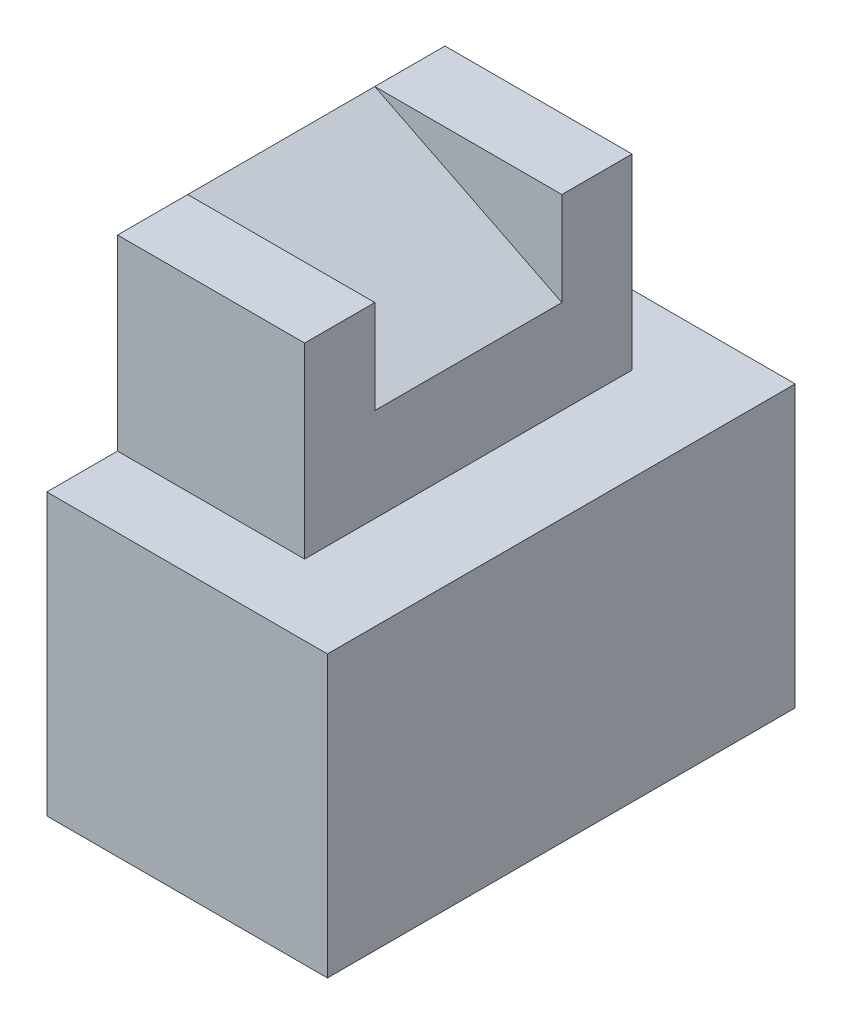
from build123d import *

# Parameters (mm, degrees)
CROQUIS1_W              = 6
CROQUIS1_H              = 10
SALIENTE_EXTRUIR1_DEPTH = 6
CROQUIS2_W              = 4
CROQUIS2_H              = 7
SALIENTE_EXTRUIR3_DEPTH = 4
CROQUIS4_W              = 4
CROQUIS4_H              = 4
CORTAR_EXTRUIR1_DEPTH   = 2
SALIENTE_EXTRUIR5_DEPTH = 4


with BuildPart() as part:
    # Croquis1 → Saliente-Extruir1 (new body)
    with BuildSketch(Plane(origin=(0, 0, 0), x_dir=(1, 0, 0), z_dir=(0, 1, 0))):
        Rectangle(CROQUIS1_W, CROQUIS1_H)
    extrude(amount=SALIENTE_EXTRUIR1_DEPTH)

    # Croquis2 → Saliente-Extruir3 (add)
    with BuildSketch(Plane(origin=(0, 6, 0), x_dir=(1, 0, 0), z_dir=(0, 1, 0))):
        with Locations((-1, 0.012360782)):
            Rectangle(CROQUIS2_W, CROQUIS2_H)
    extrude(amount=SALIENTE_EXTRUIR3_DEPTH)

    # Croquis4 → Cortar-Extruir1 (cut)
    with BuildSketch(Plane(origin=(0, 10, 0), x_dir=(1, 0, 0), z_dir=(0, 1, 0))):
        with Locations((-1, 0.012360782)):
            Rectangle(CROQUIS4_W, CROQUIS4_H)
    extrude(amount=-CORTAR_EXTRUIR1_DEPTH, mode=Mode.SUBTRACT)

    # Croquis6 → Saliente-Extruir5 (add)
    with BuildSketch(Plane.XY.offset(-2.012360782)):
        Polygon((-3, 10), (1, 8), (-3, 8), align=None)
    extrude(amount=SALIENTE_EXTRUIR5_DEPTH)


solid = part.part
